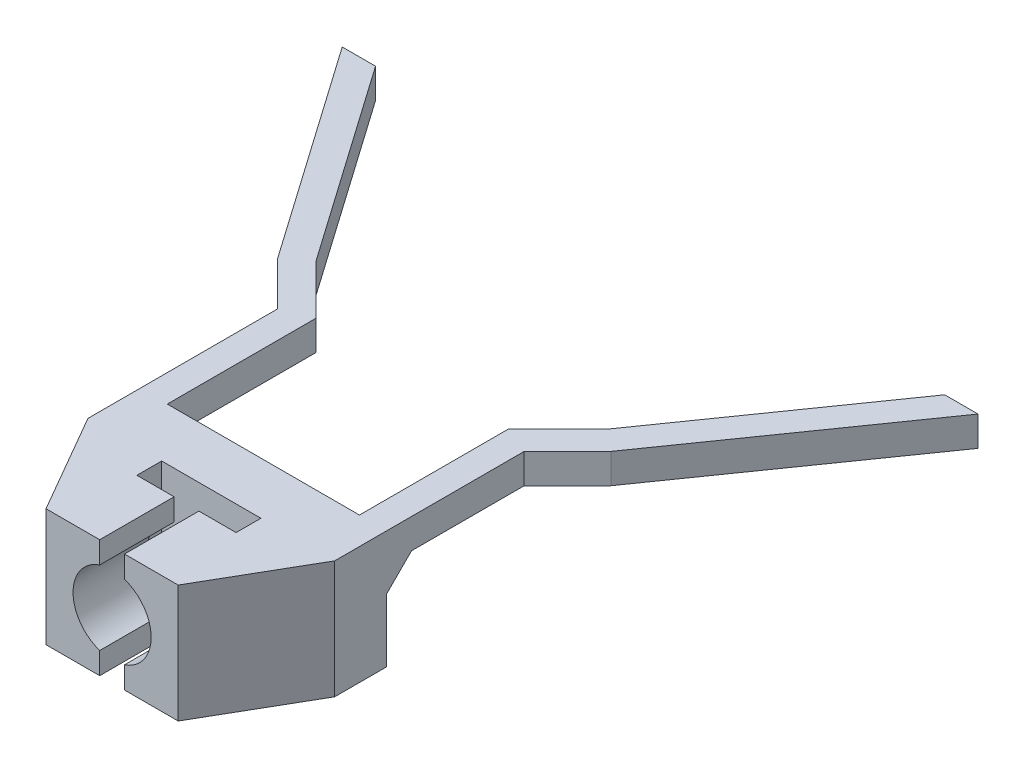
from build123d import *
from OCP.BRepFilletAPI import BRepFilletAPI_MakeChamfer

# Parameters (mm, degrees)
BOSS_EXTRUDE1_DEPTH      = 1.2
BOSS_EXTRUDE2_DEPTH      = 10
BOSS_EXTRUDE2_DEPTH_BACK = 2.2
SKETCH2_W                = 19.9
SKETCH2_H                = 9.5
CUT_EXTRUDE1_DEPTH       = 8
CUT_EXTRUDE2_DEPTH       = 42.835984366
CUT_EXTRUDE2_DEPTH_BACK  = 42.835984366
SKETCH4_W                = 8
SKETCH4_H                = 2
CHAMFER1_SIZE            = 2
CHAMFER2_SIZE            = 8
CHAMFER2_SIZE2           = 4.618802154


with BuildPart() as part:
    # Sketch1 → Boss-Extrude1 (new, symmetric)
    with BuildSketch(Plane(origin=(0, 0, 0), x_dir=(1, 0, 0), z_dir=(0, 1, 0))):
        Polygon((-7.75, 0), (0, 0), (0, -2.2), (-9.95, -2.2), (-9.95, 11.088730163), (-13.441735339, 14.580465501), (-25.639024707, 32), (-22.953320611, 32), (-11.75, 16), (-7.75, 12), align=None)
    boss_extrude1 = extrude(amount=BOSS_EXTRUDE1_DEPTH, both=True)

    # Mirror1: Boss-Extrude1 across plane
    add(boss_extrude1.mirror(Plane(origin=(0, 1.2, 0), x_dir=(0, 0, 1), z_dir=(-1, 0, 0))))

    # Sketch2 → Boss-Extrude2 (add, two sides: drawn at the far end of the back side and taken through both)
    with BuildSketch(Plane.XY.offset(2.2).offset(-BOSS_EXTRUDE2_DEPTH_BACK)):
        with Locations((0, -3.55)):
            Rectangle(SKETCH2_W, SKETCH2_H)
    extrude(amount=BOSS_EXTRUDE2_DEPTH + BOSS_EXTRUDE2_DEPTH_BACK)

    # Sketch3 → Cut-Extrude1 (cut)
    with BuildSketch(Plane.XY.offset(12.2)):
        with BuildLine():
            Line((-1, -0.562944594), (-1, 1.2))
            Line((-1, 1.2), (1, 1.2))
            Line((1, 1.2), (1, -0.562944594))
            ThreePointArc((1, -0.562944594), (3.15, -3.55), (1, -6.537055406))
            Line((1, -6.537055406), (1, -8.3))
            Line((1, -8.3), (-1, -8.3))
            Line((-1, -8.3), (-1, -6.537055406))
            ThreePointArc((-1, -6.537055406), (-3.15, -3.55), (-1, -0.562944594))
        make_face()
    extrude(amount=-CUT_EXTRUDE1_DEPTH, mode=Mode.SUBTRACT)

    # Sketch4 → Cut-Extrude2 (cut, two sides: drawn at the far end of the back side and taken through both)
    with BuildSketch(Plane(origin=(0, 0, 0), x_dir=(1, 0, 0), z_dir=(0, 1, 0)).offset(-CUT_EXTRUDE2_DEPTH_BACK)):
        with Locations((0, -5.2)):
            Rectangle(SKETCH4_W, SKETCH4_H)
    extrude(amount=CUT_EXTRUDE2_DEPTH + CUT_EXTRUDE2_DEPTH_BACK, mode=Mode.SUBTRACT)

    # Chamfer1
    chamfer1_edges = [part.edges().sort_by_distance(p)[0] for p in [
        (-8.85, -1.2, 0),
        (8.85, -1.2, 0),
    ]]
    chamfer(chamfer1_edges, length=CHAMFER1_SIZE)

    # Chamfer2: one chamfer whose edges measure the first distance from different faces: ONE call of the kernel's chamfer builder (chamfer() names one face for all edges)
    chamfer2_edges_1 = [part.edges().sort_by_distance(p)[0] for p in [
        (-9.95, -3.55, 12.2),
    ]]
    chamfer2_side_1 = [part.faces().sort_by_distance(p)[0] for p in [
        (-9.95, -2.87294894, 3.861970387),
    ]]
    chamfer2_edges_2 = [part.edges().sort_by_distance(p)[0] for p in [
        (9.95, -3.55, 12.2),
    ]]
    chamfer2_side_2 = [part.faces().sort_by_distance(p)[0] for p in [
        (9.95, -2.87294894, 3.861970387),
    ]]
    chamfer2 = BRepFilletAPI_MakeChamfer(part.part.solid().wrapped)
    for e in chamfer2_edges_1:
        chamfer2.Add(CHAMFER2_SIZE, CHAMFER2_SIZE2, e.wrapped, chamfer2_side_1[0].wrapped)  # the first distance lies on this face
    for e in chamfer2_edges_2:
        chamfer2.Add(CHAMFER2_SIZE, CHAMFER2_SIZE2, e.wrapped, chamfer2_side_2[0].wrapped)  # the first distance lies on this face
    add(Compound.cast(chamfer2.Shape()), mode=Mode.REPLACE)


solid = part.part
